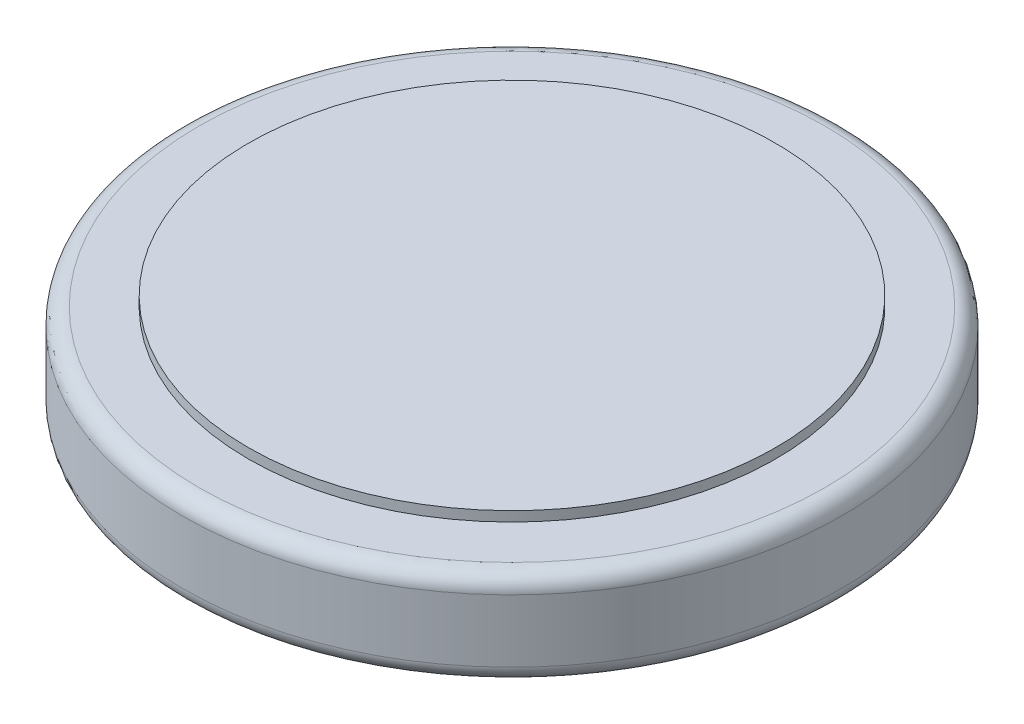
from build123d import *

# Parameters (mm, degrees)
SKETCH1_R           = 10
BOSS_EXTRUDE1_DEPTH = 2.9
SKETCH2_R           = 8
BOSS_EXTRUDE2_DEPTH = 0.3
FILLET1_R           = 0.5


with BuildPart() as part:
    # Sketch1 → Boss-Extrude1 (new body)
    with BuildSketch(Plane(origin=(0, 0, 0), x_dir=(1, 0, 0), z_dir=(0, 1, 0))):
        with Locations(Location((0, 0, 0), (0, 0, 270))):
            Circle(SKETCH1_R)
    extrude(amount=BOSS_EXTRUDE1_DEPTH)

    # Sketch2 → Boss-Extrude2 (add)
    with BuildSketch(Plane(origin=(0, 2.9, 0), x_dir=(1, 0, 0), z_dir=(0, 1, 0))):
        with Locations(Location((0, 0, 0), (0, 0, 270))):
            Circle(SKETCH2_R)
    extrude(amount=BOSS_EXTRUDE2_DEPTH)

    # Fillet1
    fillet1_edges = [part.edges().sort_by_distance(p)[0] for p in [
        (0, 0, -10),
        (0, 2.9, -10),
    ]]
    fillet(fillet1_edges, radius=FILLET1_R)


solid = part.part
